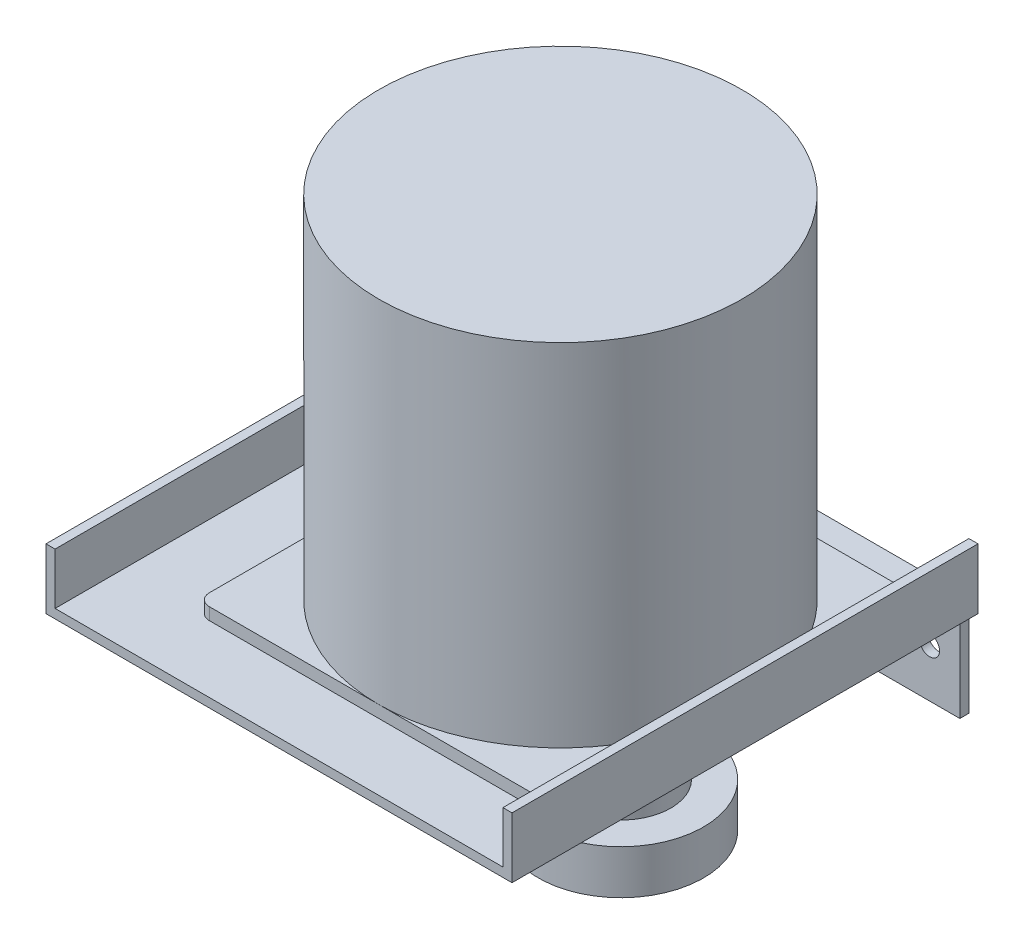
from build123d import *

# Parameters (mm, degrees)
SKETCH_1_R        = 30
EXTRUDE_1_DEPTH   = 58
SKETCH_2_W        = 60
SKETCH_2_H        = 60
EXTRUDE_2_DEPTH   = 2
FILLET_1_R        = 2
SKETCH_3_W        = 77
SKETCH_3_H        = 77
EXTRUDE_3_DEPTH   = 1.5
SKETCH_4_W        = 1.5
SKETCH_4_H        = 77
EXTRUDE_4_DEPTH   = 8.5
SKETCH_5_W        = 74
SKETCH_5_H        = 1.5
EXTRUDE_5_DEPTH   = 15
SKETCH_6_R        = 3.5
EXTRUDE_6_DEPTH   = 10
SKETCH_7_R        = 8.25
EXTRUDE_7_DEPTH   = 7.7
SKETCH_8_R        = 13.65
EXTRUDE_8_DEPTH   = 7.3
HOLE_WIZARD_M41_D = 3.3


with BuildPart() as part:
    # Эскиз1 → Бобышка-Вытянуть1 (new body)
    with BuildSketch(Plane(origin=(0, 0, 0), x_dir=(1, 0, 0), z_dir=(0, 1, 0))):
        with Locations(Location((0, 0, 0), (0, 0, 90))):
            Circle(SKETCH_1_R)
    extrude(amount=EXTRUDE_1_DEPTH)

    # Эскиз2 → Бобышка-Вытянуть2 (add)
    with BuildSketch(Plane.XZ):
        Rectangle(SKETCH_2_W, SKETCH_2_H)
    extrude(amount=EXTRUDE_2_DEPTH)

    # Скругление1
    fillet_1_edges = [part.edges().sort_by_distance(p)[0] for p in [
        (30, -1, -30),
        (30, -1, 30),
        (-30, -1, 30),
        (-30, -1, -30),
    ]]
    fillet(fillet_1_edges, radius=FILLET_1_R)

    # Эскиз3 → Бобышка-Вытянуть3 (add)
    with BuildSketch(Plane.XZ.offset(2)):
        with Locations((-5.5, 2.5)):
            Rectangle(SKETCH_3_W, SKETCH_3_H)
    extrude(amount=EXTRUDE_3_DEPTH)

    # Эскиз4 → Бобышка-Вытянуть4 (add)
    with BuildSketch(Plane(origin=(0, -2, 0), x_dir=(1, 0, 0), z_dir=(0, 1, 0))):
        with Locations((32.25, -2.5)):
            Rectangle(SKETCH_4_W, SKETCH_4_H)
        with Locations((-43.25, -2.5)):
            Rectangle(SKETCH_4_W, SKETCH_4_H)
    extrude(amount=EXTRUDE_4_DEPTH)

    # Эскиз5 → Бобышка-Вытянуть5 (add)
    with BuildSketch(Plane.XZ.offset(3.5)):
        with Locations((-5.5, -35.25)):
            Rectangle(SKETCH_5_W, SKETCH_5_H)
    extrude(amount=EXTRUDE_5_DEPTH)

    # Эскиз6 → Бобышка-Вытянуть6 (add)
    with BuildSketch(Plane.XZ.offset(3.5)):
        with Locations(Location((9.5, -0.5, 0), (0, 0, 90))):
            Circle(SKETCH_6_R)
    extrude(amount=EXTRUDE_6_DEPTH)

    # Эскиз7 → Бобышка-Вытянуть7 (add)
    with BuildSketch(Plane.XZ.offset(13.5)):
        with Locations(Location((9.5, -0.5, 0), (0, 0, 90))):
            Circle(SKETCH_7_R)
    extrude(amount=EXTRUDE_7_DEPTH)

    # Эскиз8 → Бобышка-Вытянуть8 (add)
    with BuildSketch(Plane.XZ.offset(21.2)):
        with Locations(Location((9.5, -0.5, 0), (0, 0, 270))):
            Circle(SKETCH_8_R)
    extrude(amount=EXTRUDE_8_DEPTH)

    # Отверстие обработанное метчиком M41 (through all)
    with Locations(Plane(origin=(0, 0, -36), x_dir=(-1, 0, 0), z_dir=(0, 0, -1))):
        with Locations((37.5, -10.5), (-26.5, -10.5)):
            Hole(HOLE_WIZARD_M41_D / 2)


solid = part.part
